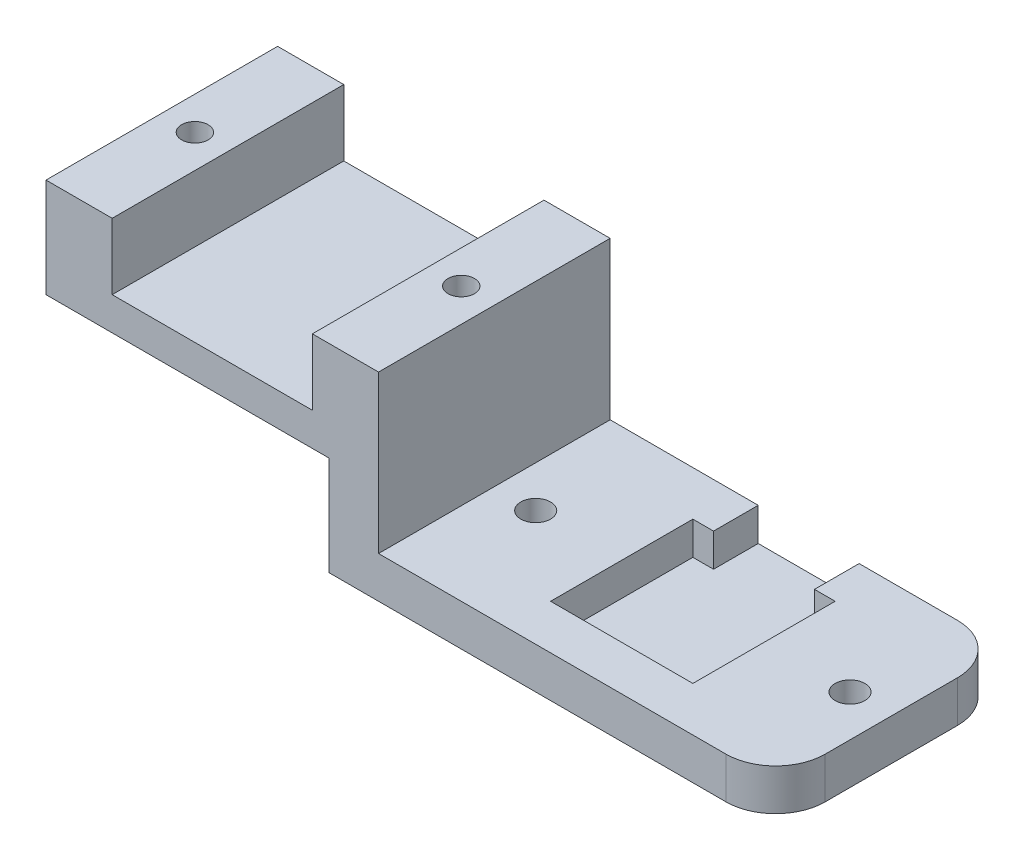
from build123d import *

# Parameters (mm, degrees)
SKETCH_4_W             = 20.1
SKETCH_4_H             = 14
EXTRUDE_3_DEPTH        = 6
SKETCH_5_W             = 12.1
SKETCH_5_H             = 4
CUT_EXTRUDE_1_DEPTH    = 19.24835609
SKETCH_6_W             = 3
SKETCH_6_H             = 14
EXTRUDE_4_DEPTH        = 6
EXTRUDE_START          = -6
EXTRUDE_5_DEPTH        = 2
SKETCH_8_W             = 14
SKETCH_8_H             = 2.5
EXTRUDE_6_DEPTH        = 24
CUT_EXTRUDE_2_DEPTH    = 2
SKETCH_10_R            = 0.9
CUT_EXTRUDE_3_DEPTH    = 37.036821447
FILLET_1_R             = 3
HOLE_WIZARD_M2_2_D     = 1.6
HOLE_WIZARD_M2_2_DEPTH = 6
HOLE_WIZARD_M2_2_TIP   = 0.480688495


with BuildPart() as part:
    # 草图4 → 凸台-拉伸3 (new body)
    with BuildSketch(Plane(origin=(0, 0, 0), x_dir=(1, 0, 0), z_dir=(0, 1, 0))):
        Rectangle(SKETCH_4_W, SKETCH_4_H)
    extrude(amount=EXTRUDE_3_DEPTH)

    # 草图5 → 切除-拉伸1 (cut, through all)
    with BuildSketch(Plane.XY.offset(7)):
        with Locations((0, 4)):
            Rectangle(SKETCH_5_W, SKETCH_5_H)
    extrude(amount=-CUT_EXTRUDE_1_DEPTH, mode=Mode.SUBTRACT)

    # 草图6 → 凸台-拉伸4 (add)
    with BuildSketch(Plane.XZ):
        with Locations((8.55, 0)):
            Rectangle(SKETCH_6_W, SKETCH_6_H)
    extrude(amount=EXTRUDE_4_DEPTH)

    # 草图7 → 凸台-拉伸5 (add)
    with BuildSketch(Plane(origin=(0, 0, -7), x_dir=(-1, 0, 0), z_dir=(0, 0, -1)).offset(EXTRUDE_START)):
        Polygon((-7.05, -6), (0, 0), (-7.05, 0), align=None)
    extrude(amount=EXTRUDE_5_DEPTH)

    # 草图8 → 凸台-拉伸6 (add)
    with BuildSketch(Plane(origin=(10.05, 0, 0), x_dir=(0, 0, -1), z_dir=(1, 0, 0))):
        with Locations((0, -4.75)):
            Rectangle(SKETCH_8_W, SKETCH_8_H)
    extrude(amount=EXTRUDE_6_DEPTH)

    # 草图9 → 切除-拉伸2 (cut)
    with BuildSketch(Plane(origin=(0, -3.5, 0), x_dir=(1, 0, 0), z_dir=(0, 1, 0))):
        Polygon((17.75, 4.3), (17.75, -4.3), (26.35, -4.3), (26.35, 4.3), (25.1, 4.3), (25.1, 7), (19, 7), (19, 4.3), align=None)
    extrude(amount=-CUT_EXTRUDE_2_DEPTH, mode=Mode.SUBTRACT)

    # 草图10 → 切除-拉伸3 (cut, through all)
    with BuildSketch(Plane(origin=(0, -3.5, 0), x_dir=(1, 0, 0), z_dir=(0, 1, 0))):
        with Locations(Location((12.55, 0, 0), (0, 0, 270))):
            Circle(SKETCH_10_R)
        with Locations(Location((31.55, 0, 0), (0, 0, 270))):
            Circle(SKETCH_10_R)
    extrude(amount=-CUT_EXTRUDE_3_DEPTH, mode=Mode.SUBTRACT)

    # 圆角1
    fillet_1_edges = [part.edges().sort_by_distance(p)[0] for p in [
        (34.05, -4.75, 7),
        (34.05, -4.75, -7),
    ]]
    fillet(fillet_1_edges, radius=FILLET_1_R)

    # M2 螺纹孔的螺纹孔钻头2
    with Locations(Plane(origin=(-8.05, 6, 0), x_dir=(0, 0, 1), z_dir=(0, 1, 0))):
        with Locations((0, 0), (0, 16.1)):
            Hole(HOLE_WIZARD_M2_2_D / 2, depth=HOLE_WIZARD_M2_2_DEPTH)
            with Locations((0, 0, -(HOLE_WIZARD_M2_2_DEPTH + HOLE_WIZARD_M2_2_TIP / 2))):  # 118° drill point
                Cone(0, HOLE_WIZARD_M2_2_D / 2, HOLE_WIZARD_M2_2_TIP, mode=Mode.SUBTRACT)


solid = part.part
